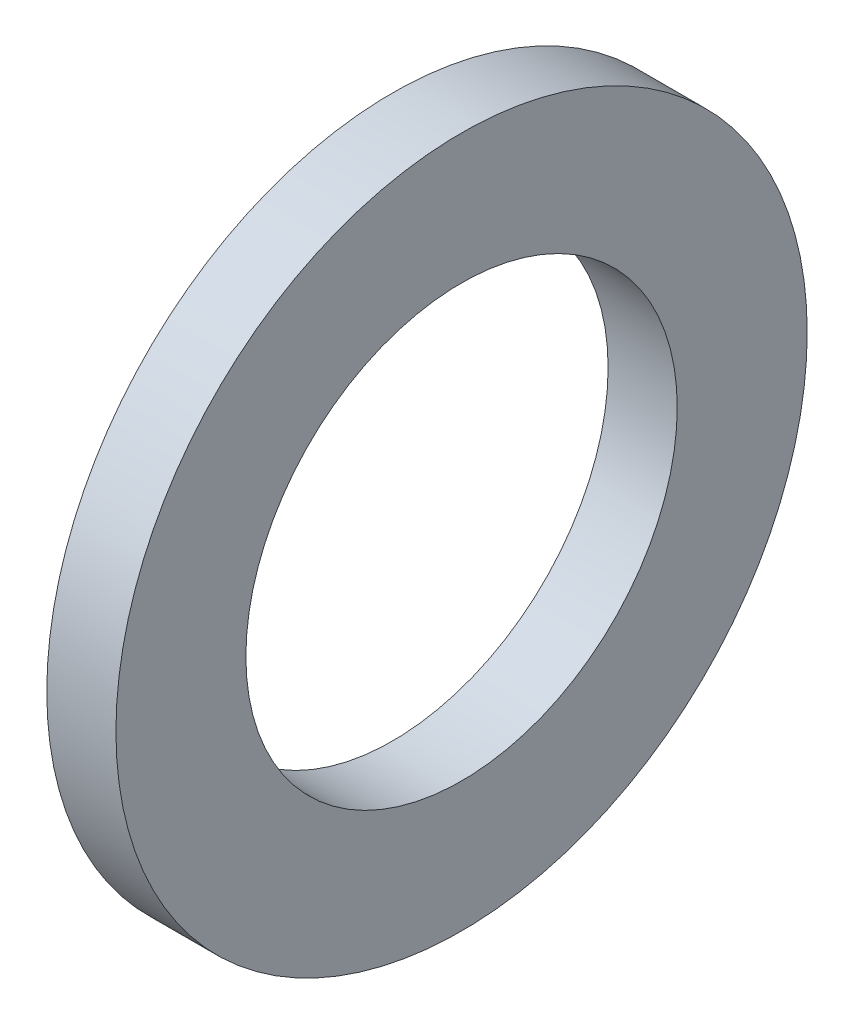
from build123d import *

# Parameters (mm, degrees)
SKETCH1_R           = 7.9375
SKETCH1_R_2         = 4.953
BOSS_EXTRUDE1_DEPTH = 1.5875


with BuildPart() as part:
    # Sketch1 → Boss-Extrude1 (new body)
    with BuildSketch(Plane(origin=(0, 0, 0), x_dir=(0, 0, -1), z_dir=(1, 0, 0))):
        Circle(SKETCH1_R)
        Circle(SKETCH1_R_2, mode=Mode.SUBTRACT)
    extrude(amount=BOSS_EXTRUDE1_DEPTH)


solid = part.part
